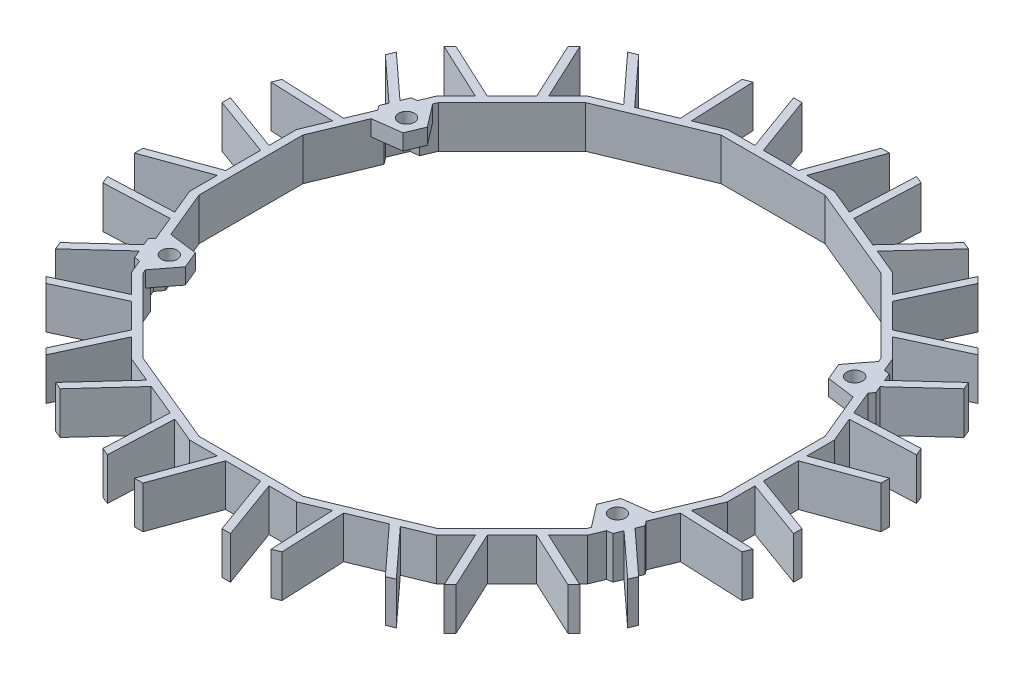
from build123d import *

# Parameters (mm, degrees)
BOSS_EXTRUDE1_DEPTH  = 1.6
BOSS_EXTRUDE5_DEPTH  = 8
SKETCH6_R            = 1.5
CUT_EXTRUDE2_DEPTH   = 1.6
BOSS_EXTRUDE9_DEPTH  = 8
CUT_EXTRUDE5_DEPTH   = 8
BOSS_EXTRUDE11_DEPTH = 8
SKETCH22_R           = 1.5
BOSS_EXTRUDE12_DEPTH = 3
BOSS_EXTRUDE13_DEPTH = 3
CUT_EXTRUDE6_DEPTH   = 1.6


with BuildPart() as part:
    # Sketch1 → Boss-Extrude1 (new body)
    with BuildSketch(Plane(origin=(0, 0, 0), x_dir=(1, 0, 0), z_dir=(0, 1, 0))):
        Polygon((62.5, 12.432022961), (52.984941564, 35.403406084), (35.403406084, 52.984941564), (12.432022961, 62.5), (-12.432022961, 62.5), (-35.403406084, 52.984941564), (-52.984941564, 35.403406084), (-62.5, 12.432022961), (-62.5, -12.432022961), (-52.984941564, -35.403406084), (-35.403406084, -52.984941564), (-12.432022961, -62.5), (12.432022961, -62.5), (35.403406084, -52.984941564), (52.984941564, -35.403406084), (62.5, -12.432022961), align=None)
    extrude(amount=BOSS_EXTRUDE1_DEPTH)

    # Sketch2 → Boss-Extrude5 (add)
    with BuildSketch(Plane.XZ):
        Polygon((-7.5, 62.5), (-3.314342306, 51), (3.314342306, 51), (7.5, 62.5), (9.096266659, 62.5), (4.364653613, 49.5), (-4.364653613, 49.5), (-9.096266659, 62.5), align=None)
        Polygon((15.513859935, 61.223461329), (16.988618029, 60.612596525), (16.45480203, 48.386200048), (22.578908071, 45.849512268), (30.846811017, 54.872345039), (32.321569111, 54.261480235), (22.975244042, 44.061756234), (14.910415762, 47.402317485), align=None)
        Polygon((37.762141986, 50.626205662), (38.890872965, 49.497474683), (33.718851921, 38.40603976), (38.40603976, 33.718851921), (49.497474683, 38.890872965), (50.626205662, 37.762141986), (38.088061836, 31.915509501), (31.915509501, 38.088061836), align=None)
        Polygon((54.261480235, 32.321569111), (54.872345039, 30.846811017), (45.849512268, 22.578908071), (48.386200048, 16.45480203), (60.612596525, 16.988618029), (61.223461329, 15.513859935), (47.402317485, 14.910415762), (44.061756234, 22.975244042), align=None)
        Polygon((62.5, 9.096266659), (62.5, 7.5), (51, 3.314342306), (51, -3.314342306), (62.5, -7.5), (62.5, -9.096266659), (49.5, -4.364653613), (49.5, 4.364653613), align=None)
        Polygon((61.223461329, -15.513859935), (60.612596525, -16.988618029), (48.386200048, -16.45480203), (45.849512268, -22.578908071), (54.872345039, -30.846811017), (54.261480235, -32.321569111), (44.061756234, -22.975244042), (47.402317485, -14.910415762), align=None)
        Polygon((50.626205662, -37.762141986), (49.497474683, -38.890872965), (38.40603976, -33.718851921), (33.718851921, -38.40603976), (38.890872965, -49.497474683), (37.762141986, -50.626205662), (31.915509501, -38.088061836), (38.088061836, -31.915509501), align=None)
        Polygon((32.321569111, -54.261480235), (30.846811017, -54.872345039), (22.578908071, -45.849512268), (16.45480203, -48.386200048), (16.988618029, -60.612596525), (15.513859935, -61.223461329), (14.910415762, -47.402317485), (22.975244042, -44.061756234), align=None)
        Polygon((9.096266659, -62.5), (7.5, -62.5), (3.314342306, -51), (-3.314342306, -51), (-7.5, -62.5), (-9.096266659, -62.5), (-4.364653613, -49.5), (4.364653613, -49.5), align=None)
        Polygon((-15.513859935, -61.223461329), (-16.988618029, -60.612596525), (-16.45480203, -48.386200048), (-22.578908071, -45.849512268), (-30.846811017, -54.872345039), (-32.321569111, -54.261480235), (-22.975244042, -44.061756234), (-14.910415762, -47.402317485), align=None)
        Polygon((-37.762141986, -50.626205662), (-38.890872965, -49.497474683), (-33.718851921, -38.40603976), (-38.40603976, -33.718851921), (-49.497474683, -38.890872965), (-50.626205662, -37.762141986), (-38.088061836, -31.915509501), (-31.915509501, -38.088061836), align=None)
        Polygon((-54.261480235, -32.321569111), (-54.872345039, -30.846811017), (-45.849512268, -22.578908071), (-48.386200048, -16.45480203), (-60.612596525, -16.988618029), (-61.223461329, -15.513859935), (-47.402317485, -14.910415762), (-44.061756234, -22.975244042), align=None)
        Polygon((-62.5, -9.096266659), (-62.5, -7.5), (-51, -3.314342306), (-51, 3.314342306), (-62.5, 7.5), (-62.5, 9.096266659), (-49.5, 4.364653613), (-49.5, -4.364653613), align=None)
        Polygon((-61.223461329, 15.513859935), (-60.612596525, 16.988618029), (-48.386200048, 16.45480203), (-45.849512268, 22.578908071), (-54.872345039, 30.846811017), (-54.261480235, 32.321569111), (-44.061756234, 22.975244042), (-47.402317485, 14.910415762), align=None)
        Polygon((-50.626205662, 37.762141986), (-49.497474683, 38.890872965), (-38.40603976, 33.718851921), (-33.718851921, 38.40603976), (-38.890872965, 49.497474683), (-37.762141986, 50.626205662), (-31.915509501, 38.088061836), (-38.088061836, 31.915509501), align=None)
        Polygon((-32.321569111, 54.261480235), (-30.846811017, 54.872345039), (-22.578908071, 45.849512268), (-16.45480203, 48.386200048), (-16.988618029, 60.612596525), (-15.513859935, 61.223461329), (-14.910415762, 47.402317485), (-22.975244042, 44.061756234), align=None)
    extrude(amount=BOSS_EXTRUDE5_DEPTH)

    # Sketch6 → Cut-Extrude2 (cut)
    with BuildSketch(Plane(origin=(0, 1.6, 0), x_dir=(1, 0, 0), z_dir=(0, 1, 0))):
        with Locations(Location((-42.5, 22.5, 0), (0, 0, 270))):
            Circle(SKETCH6_R)
        with Locations(Location((-42.5, -22.5, 0), (0, 0, 270))):
            Circle(SKETCH6_R)
        with Locations(Location((42.5, -22.5, 0), (0, 0, 270))):
            Circle(SKETCH6_R)
        with Locations(Location((42.5, 22.5, 0), (0, 0, 270))):
            Circle(SKETCH6_R)
    extrude(amount=-CUT_EXTRUDE2_DEPTH, mode=Mode.SUBTRACT)

    # Sketch17 → Boss-Extrude9 (add)
    with BuildSketch(Plane.XZ.offset(8)):
        Polygon((-10.144530736, 51), (-28.889179365, 43.235712316), (-43.235712316, 28.889179365), (-51, 10.144530736), (-51, -10.144530736), (-43.235712316, -28.889179365), (-28.889179365, -43.235712316), (-10.144530736, -51), (10.144530736, -51), (28.889179365, -43.235712316), (43.235712316, -28.889179365), (51, -10.144530736), (51, 10.144530736), (43.235712316, 28.889179365), (28.889179365, 43.235712316), (10.144530736, 51), align=None)
        Polygon((-9.846162185, 49.5), (-28.039497619, 41.964073719), (-41.964073719, 28.039497619), (-49.5, 9.846162185), (-49.5, -9.846162185), (-41.964073719, -28.039497619), (-28.039497619, -41.964073719), (-9.846162185, -49.5), (9.846162185, -49.5), (28.039497619, -41.964073719), (41.964073719, -28.039497619), (49.5, -9.846162185), (49.5, 9.846162185), (41.964073719, 28.039497619), (28.039497619, 41.964073719), (9.846162185, 49.5), align=None, mode=Mode.SUBTRACT)
    extrude(amount=-BOSS_EXTRUDE9_DEPTH)

    # Sketch16 → Cut-Extrude5 (cut)
    with BuildSketch(Plane.XZ.offset(8)):
        Polygon((-43.847748534, 19.24624721), (-40.356041693, 19.705939136), (-39.008293159, 22.959691927), (-41.152251466, 25.75375279), (-44.643958307, 25.294060864), (-45.991706841, 22.040308073), align=None)
        Polygon((45.991706841, 22.040308073), (43.847748534, 19.24624721), (40.356041693, 19.705939136), (39.008293159, 22.959691927), (41.152251466, 25.75375279), (44.643958307, 25.294060864), align=None)
        Polygon((44.643958307, -25.294060864), (45.991706841, -22.040308073), (43.847748534, -19.24624721), (40.356041693, -19.705939136), (39.008293159, -22.959691927), (41.152251466, -25.75375279), align=None)
        Polygon((-45.991706841, -22.040308073), (-43.847748534, -19.24624721), (-40.356041693, -19.705939136), (-39.008293159, -22.959691927), (-41.152251466, -25.75375279), (-44.643958307, -25.294060864), align=None)
    extrude(amount=-CUT_EXTRUDE5_DEPTH, mode=Mode.SUBTRACT)

    # Sketch21 → Boss-Extrude11 (add)
    with BuildSketch(Plane.XZ):
        Polygon((-47.136528757, 21.889589409), (-45.43172526, 19.667846237), (-44.989840495, 20.734650431), (-45.991706841, 22.040308073), (-44.643958307, 25.294060864), (-43.012292446, 25.50887375), (-42.570407681, 26.575677943), (-45.346895457, 26.210146393), align=None)
        Polygon((43.012292446, 25.50887375), (42.570407681, 26.575677943), (45.346895457, 26.210146393), (47.136528757, 21.889589409), (45.43172526, 19.667846237), (44.989840495, 20.734650431), (45.991706841, 22.040308073), (44.643958307, 25.294060864), align=None)
        Polygon((43.012292446, -25.50887375), (44.643958307, -25.294060864), (45.991706841, -22.040308073), (44.989840495, -20.734650431), (45.43172526, -19.667846237), (47.136528757, -21.889589409), (45.346895457, -26.210146393), (42.570407681, -26.575677943), align=None)
        Polygon((-44.989840495, -20.734650431), (-45.43172526, -19.667846237), (-47.136528757, -21.889589409), (-45.346895457, -26.210146393), (-42.570407681, -26.575677943), (-43.012292446, -25.50887375), (-44.643958307, -25.294060864), (-45.991706841, -22.040308073), align=None)
    extrude(amount=BOSS_EXTRUDE11_DEPTH)

    # Sketch22 → Boss-Extrude12 (add)
    # profile 1 of 4: a face of its own
    with BuildSketch(Plane.XZ):
        Polygon((44.643958307, 25.294060864), (41.152251466, 25.75375279), (39.008293159, 22.959691927), (40.356041693, 19.705939136), (43.847748534, 19.24624721), (45.991706841, 22.040308073), align=None)
        with Locations(Location((42.5, 22.5, 0), (0, 0, 90))):
            Circle(SKETCH22_R, mode=Mode.SUBTRACT)
    # profile 2 of 4: a face of its own
    with BuildSketch(Plane.XZ):
        Polygon((-45.991706841, 22.040308073), (-44.643958307, 25.294060864), (-41.152251466, 25.75375279), (-39.008293159, 22.959691927), (-40.356041693, 19.705939136), (-43.847748534, 19.24624721), align=None)
        with Locations(Location((-42.5, 22.5, 0), (0, 0, 90))):
            Circle(SKETCH22_R, mode=Mode.SUBTRACT)
    # profile 3 of 4: a face of its own
    with BuildSketch(Plane.XZ):
        Polygon((-44.643958307, -25.294060864), (-41.152251466, -25.75375279), (-39.008293159, -22.959691927), (-40.356041693, -19.705939136), (-43.847748534, -19.24624721), (-45.991706841, -22.040308073), align=None)
        with Locations(Location((-42.5, -22.5, 0), (0, 0, 90))):
            Circle(SKETCH22_R, mode=Mode.SUBTRACT)
    # profile 4 of 4: a face of its own
    with BuildSketch(Plane.XZ):
        Polygon((45.991706841, -22.040308073), (44.643958307, -25.294060864), (41.152251466, -25.75375279), (39.008293159, -22.959691927), (40.356041693, -19.705939136), (43.847748534, -19.24624721), align=None)
        with Locations(Location((42.5, -22.5, 0), (0, 0, 90))):
            Circle(SKETCH22_R, mode=Mode.SUBTRACT)
    extrude(amount=BOSS_EXTRUDE12_DEPTH)

    # Sketch23 → Boss-Extrude13 (add)
    with BuildSketch(Plane.XZ.offset(3)):
        Polygon((-41.152251466, 25.75375279), (-42.294343426, 27.242156012), (-43.012292446, 25.50887375), align=None)
        Polygon((-43.847748534, 19.24624721), (-45.707789515, 19.001368169), (-44.989840495, 20.734650431), align=None)
        Polygon((-43.847748534, -19.24624721), (-45.707789515, -19.001368169), (-44.989840495, -20.734650431), align=None)
        Polygon((-42.294343426, -27.242156012), (-43.012292446, -25.50887375), (-41.152251466, -25.75375279), align=None)
        Polygon((43.012292446, -25.50887375), (41.152251466, -25.75375279), (42.294343426, -27.242156012), align=None)
        Polygon((45.707789515, -19.001368169), (44.989840495, -20.734650431), (43.847748534, -19.24624721), align=None)
        Polygon((45.707789515, 19.001368169), (44.989840495, 20.734650431), (43.847748534, 19.24624721), align=None)
        Polygon((43.012292446, 25.50887375), (41.152251466, 25.75375279), (42.294343426, 27.242156012), align=None)
    extrude(amount=-BOSS_EXTRUDE13_DEPTH)

    # Sketch18 → Cut-Extrude6 (cut)
    with BuildSketch(Plane(origin=(0, 1.6, 0), x_dir=(1, 0, 0), z_dir=(0, 1, 0))):
        Polygon((-35.403406084, 52.984941564), (-52.984941564, 35.403406084), (-62.5, 12.432022961), (-62.5, -12.432022961), (-52.984941564, -35.403406084), (-35.403406084, -52.984941564), (-12.432022961, -62.5), (12.432022961, -62.5), (35.403406084, -52.984941564), (52.984941564, -35.403406084), (62.5, -12.432022961), (62.5, 12.432022961), (52.984941564, 35.403406084), (35.403406084, 52.984941564), (12.432022961, 62.5), (-12.432022961, 62.5), align=None)
    extrude(amount=-CUT_EXTRUDE6_DEPTH, mode=Mode.SUBTRACT)


solid = part.part
